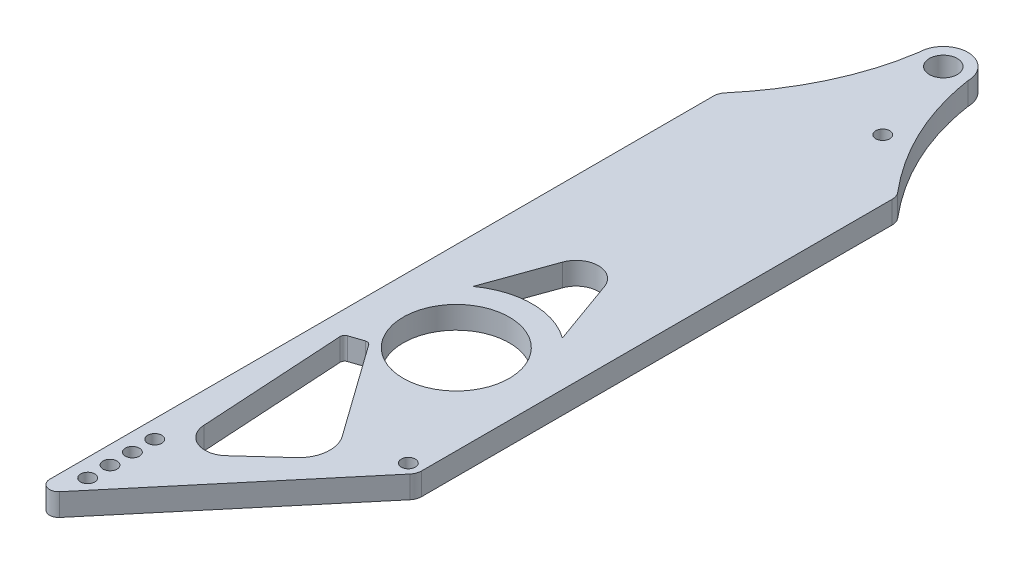
from build123d import *

# Parameters (mm, degrees)
SKETCH1_R           = 3.96875
SKETCH1_R_2         = 15.08125
SKETCH1_R_3         = 2
BOSS_EXTRUDE1_DEPTH = 6.35


with BuildPart() as part:
    # Sketch1 → Boss-Extrude1 (new body)
    with BuildSketch(Plane(origin=(0, 0, 0), x_dir=(1, 0, 0), z_dir=(0, 1, 0))):
        with BuildLine():
            Line((25.4, -39.926769414), (25.4, -173.650783549))
            ThreePointArc((25.4, -173.650783549), (25.170228885, -174.953880295), (24.508629328, -176.099804342))
            Line((24.508629328, -176.099804342), (-20.914247114, -230.232680529))
            ThreePointArc((-20.914247114, -230.232680529), (-23.728731164, -230.986819257), (-25.4, -228.6))
            Line((-25.4, -228.6), (-25.4, -39.926769414))
            ThreePointArc((-25.4, -39.926769414), (-25.169027772, -38.620377357), (-24.504115377, -37.472379149))
            add(Edge.make_bspline(
                [(-24.504115377, -37.472379149), (-15.341464403, -26.593497135), (-9.143369894, -14.104472305), (-6.985, 0)],
                knots=[0.031078099, 0.031078099, 0.031078099, 0.031078099, 1, 1, 1, 1], degree=3))
            ThreePointArc((-6.985, 0), (0, 6.985), (6.985, 0))
            add(Edge.make_bspline(
                [(24.504115377, -37.472379149), (15.363034866, -26.619107902), (9.178211427, -14.199965817), (6.985, 0)],
                knots=[0.031766068, 0.031766068, 0.031766068, 0.031766068, 1, 1, 1, 1], degree=3))
            ThreePointArc((24.504115377, -37.472379149), (25.169027772, -38.620377357), (25.4, -39.926769414))
        make_face()
        with Locations(Location((0, 0, 0), (0, 0, 270))):
            Circle(SKETCH1_R, mode=Mode.SUBTRACT)
        with Locations(Location((0, -138.43, 0), (0, 0, 270))):
            Circle(SKETCH1_R_2, mode=Mode.SUBTRACT)
        with Locations(Location((-20.32, -222.878592645, 0), (0, 0, 270))):
            Circle(SKETCH1_R_3, mode=Mode.SUBTRACT)
        with Locations(Location((-20.32, -216.528592645, 0), (0, 0, 270))):
            Circle(SKETCH1_R_3, mode=Mode.SUBTRACT)
        with Locations(Location((-20.32, -210.178592645, 0), (0, 0, 270))):
            Circle(SKETCH1_R_3, mode=Mode.SUBTRACT)
        with Locations(Location((-20.32, -203.828592645, 0), (0, 0, 270))):
            Circle(SKETCH1_R_3, mode=Mode.SUBTRACT)
        with Locations(Location((21.59, -173.650783549, 0), (0, 0, 270))):
            Circle(SKETCH1_R_3, mode=Mode.SUBTRACT)
        with Locations(Location((8.19455983, -25.4, 0), (0, 0, 270))):
            Circle(SKETCH1_R_3, mode=Mode.SUBTRACT)
        with BuildLine():
            Line((5.605496622, -176.452263434), (-13.166879596, -150.15491695))
            ThreePointArc((-13.166879596, -150.15491695), (-13.808086261, -149.684948511), (-14.603073846, -149.688274478))
            Line((-14.603073846, -149.688274478), (-18.395861473, -150.955793975))
            ThreePointArc((-18.395861473, -150.955793975), (-19.045805463, -151.449552817), (-19.26101006, -152.2368977))
            Line((-19.26101006, -152.2368977), (-16.771936742, -193.436924326))
            ThreePointArc((-16.771936742, -193.436924326), (-12.825939472, -198.936057494), (-6.161826947, -197.752434107))
            Line((-6.161826947, -197.752434107), (4.350250475, -188.195205906))
            ThreePointArc((4.350250475, -188.195205906), (7.209558699, -182.562287673), (5.605496622, -176.452263434))
        make_face(mode=Mode.SUBTRACT)
        with BuildLine():
            Line((-12.7, -120.970386602), (-5.976567434, -102.241338504))
            ThreePointArc((-5.976567434, -102.241338504), (0, -98.036831852), (5.976567434, -102.241338504))
            Line((5.976567434, -102.241338504), (12.7, -120.970386602))
            ThreePointArc((12.7, -120.970386602), (0, -116.84), (-12.7, -120.970386602))
        make_face(mode=Mode.SUBTRACT)
    extrude(amount=-BOSS_EXTRUDE1_DEPTH)


solid = part.part
